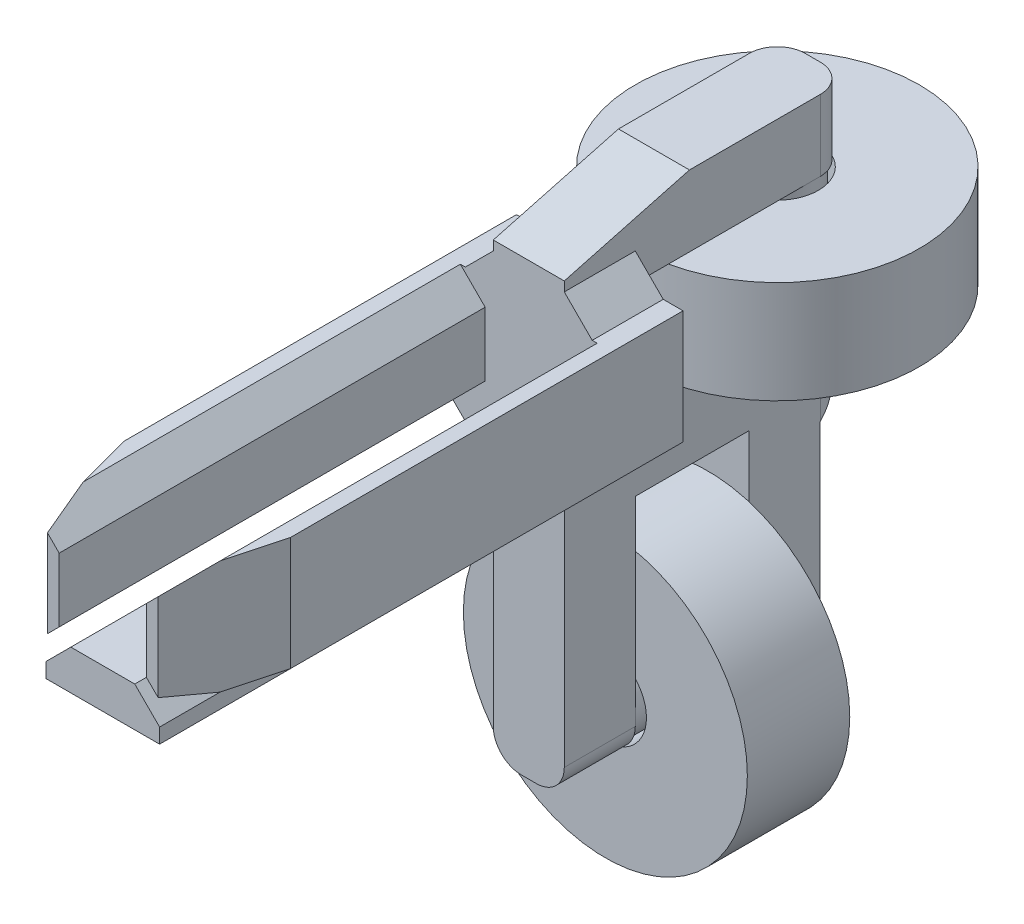
from build123d import *

# Parameters (mm, degrees)
BOSS_EXTRUDE1_DEPTH   = 38.1
BOSS_EXTRUDE1_2_DEPTH = 38.1
BOSS_EXTRUDE1_3_DEPTH = 38.1
CHAMFER1_SIZE         = 2.5
CHAMFER1_SIZE2        = 9.330127019
CHAMFER2_SIZE         = 2.5
CHAMFER2_SIZE2        = 9.330127019
BOSS_EXTRUDE2_DEPTH   = 6.35
BOSS_EXTRUDE3_START   = -6.35
SKETCH4_W             = 6.35
SKETCH4_H             = 6.35
BOSS_EXTRUDE3_DEPTH   = 25.4
BOSS_EXTRUDE4_REACH   = 44.186
SKETCH5_R             = 3.175
BOSS_EXTRUDE5_START   = 0.5
SKETCH6_R             = 12.7
SKETCH6_R_2           = 3.675
BOSS_EXTRUDE5_DEPTH   = 9.16
SKETCH7_W             = 6.35
SKETCH7_H             = 20.32
BOSS_EXTRUDE6_DEPTH   = 6.35
BOSS_EXTRUDE7_REACH   = 66.433
SKETCH8_R             = 3.175
BOSS_EXTRUDE8_START   = 0.5
SKETCH9_R             = 12.7
SKETCH9_R_2           = 3.675
BOSS_EXTRUDE8_DEPTH   = 9.16
CHAMFER3_SIZE         = 2.5
FILLET1_R             = 2.5
CHAMFER4_SIZE         = 3
CHAMFER4_SIZE2        = 11.196152423


with BuildPart() as part:
    # Sketch1 → Boss-Extrude1 (new body)
    with BuildSketch(Plane.XY):
        Polygon((6.12, -5.08), (3.9, -2.86), (3.9, 2.86), (6.12, 5.08), (7.45, 5.08), (7.45, -5.08), align=None)
    extrude(amount=BOSS_EXTRUDE1_DEPTH)

    # Chamfer1
    chamfer1_edges = [part.edges().sort_by_distance(p)[0] for p in [
        (7.45, 0, 38.1),
    ]]
    chamfer1_side = [part.faces().sort_by_distance(p)[0] for p in [
        (5.838807306, 0, 38.1),
    ]]
    chamfer(chamfer1_edges, length=CHAMFER1_SIZE, length2=CHAMFER1_SIZE2, reference=chamfer1_side[0])



with BuildPart() as body_2:
    # Sketch1 → Boss-Extrude1 2 (new body)
    with BuildSketch(Plane.XY):
        Polygon((-6.12, -5.08), (-3.9, -2.86), (-3.9, 2.86), (-6.12, 5.08), (-7.45, 5.08), (-7.45, -5.08), align=None)
    extrude(amount=BOSS_EXTRUDE1_2_DEPTH)

    # Chamfer2
    chamfer2_edges = [body_2.edges().sort_by_distance(p)[0] for p in [
        (-7.45, 0, 38.1),
    ]]
    chamfer2_side = [body_2.faces().sort_by_distance(p)[0] for p in [
        (-5.838807306, 0, 38.1),
    ]]
    chamfer(chamfer2_edges, length=CHAMFER2_SIZE, length2=CHAMFER2_SIZE2, reference=chamfer2_side[0])


with BuildPart() as body_3:
    # Sketch1 → Boss-Extrude1 3 (new body)
    with BuildSketch(Plane.XY):
        Polygon((5.08, -7.45), (-5.08, -7.45), (-5.08, -6.12), (-2.86, -3.9), (2.86, -3.9), (5.08, -6.12), align=None)
    extrude(amount=BOSS_EXTRUDE1_3_DEPTH)


with BuildPart() as part_1:
    add(part.part)

    add(body_2.part)  # Boss-Extrude2 merges body 2
    # Sketch3 → Boss-Extrude2 (add)
    with BuildSketch(Plane.XY):
        Polygon((7.45, 5.08), (-7.45, 5.08), (-7.45, -5.08), (-5.08, -7.45), (5.08, -7.45), (7.45, -5.08), align=None)
    extrude(amount=-BOSS_EXTRUDE2_DEPTH)

    # Sketch4 → Boss-Extrude3 (add)
    with BuildSketch(Plane(origin=(0, 0, -6.35), x_dir=(-1, 0, 0), z_dir=(0, 0, -1)).offset(BOSS_EXTRUDE3_START)):
        with Locations((0, 8.255)):
            Rectangle(SKETCH4_W, SKETCH4_H)
        with Locations((0, -8.255)):
            Rectangle(SKETCH4_W, SKETCH4_H)
    extrude(amount=BOSS_EXTRUDE3_DEPTH)

    # Sketch5 → Boss-Extrude4 (add, up to next)
    with BuildSketch(Plane(origin=(0, -5.08, 0), x_dir=(1, 0, 0), z_dir=(0, 1, 0)), mode=Mode.PRIVATE) as boss_extrude4_sk1:
        with Locations(Location((0, 22.225, 0), (0, 0, 90))):
            Circle(SKETCH5_R)
    boss_extrude4_tool1 = extrude(boss_extrude4_sk1.sketch, amount=BOSS_EXTRUDE4_REACH, mode=Mode.PRIVATE) - part_1.part
    add(boss_extrude4_tool1.solids().sort_by_distance((0, -5.08, -22.225))[0])

    # Sketch7 → Boss-Extrude6 (add)
    with BuildSketch(Plane(origin=(3.175, 0, 0), x_dir=(0, 0, -1), z_dir=(1, 0, 0))):
        with Locations((3.175, -21.59)):
            Rectangle(SKETCH7_W, SKETCH7_H)
        with Locations((19.685, -21.59)):
            Rectangle(SKETCH7_W, SKETCH7_H)
    extrude(amount=-BOSS_EXTRUDE6_DEPTH)

    # Sketch8 → Boss-Extrude7 (add, up to next)
    with BuildSketch(Plane.XY.offset(-16.51), mode=Mode.PRIVATE) as boss_extrude7_sk1:
        with Locations(Location((0, -28.575, 0), (0, 0, 180))):
            Circle(SKETCH8_R)
    boss_extrude7_tool1 = extrude(boss_extrude7_sk1.sketch, amount=BOSS_EXTRUDE7_REACH, mode=Mode.PRIVATE) - part_1.part
    add(boss_extrude7_tool1.solids().sort_by_distance((0, -28.575, -16.51))[0])

    # Chamfer3
    chamfer3_edges = [part_1.edges().sort_by_distance(p)[0] for p in [
        (0, -11.43, -22.86),
        (3.175, 5.08, -3.175),
        (-3.175, 5.08, -3.175),
    ]]
    chamfer(chamfer3_edges, length=CHAMFER3_SIZE)

    # Fillet1
    fillet1_edges = [part_1.edges().sort_by_distance(p)[0] for p in [
        (-3.175, -8.255, -25.4),
        (3.175, -8.255, -25.4),
        (-3.175, 8.255, -25.4),
        (3.175, 8.255, -25.4),
        (-3.175, -31.75, -3.175),
        (3.175, -31.75, -3.175),
        (-3.175, -31.75, -19.685),
        (3.175, -31.75, -19.685),
    ]]
    fillet(fillet1_edges, radius=FILLET1_R)

    # Chamfer4
    chamfer4_edges = [part_1.edges().sort_by_distance(p)[0] for p in [
        (0, 11.43, 0),
    ]]
    chamfer4_side = [part_1.faces().sort_by_distance(p)[0] for p in [
        (0, -8.69005842, 0),
    ]]
    chamfer(chamfer4_edges, length=CHAMFER4_SIZE, length2=CHAMFER4_SIZE2, reference=chamfer4_side[0])


with BuildPart() as body_3_2:
    # Sketch6 → Boss-Extrude5 (new body)
    with BuildSketch(Plane(origin=(0, -5.08, 0), x_dir=(1, 0, 0), z_dir=(0, 1, 0)).offset(BOSS_EXTRUDE5_START)):
        with Locations(Location((0, 22.225, 0), (0, 0, 270))):
            Circle(SKETCH6_R)
        with Locations(Location((0, 22.225, 0), (0, 0, 270))):
            Circle(SKETCH6_R_2, mode=Mode.SUBTRACT)
    extrude(amount=BOSS_EXTRUDE5_DEPTH)


with BuildPart() as body_4:
    # Sketch9 → Boss-Extrude8 (new body)
    with BuildSketch(Plane.XY.offset(-16.51).offset(BOSS_EXTRUDE8_START)):
        with Locations((0, -28.575)):
            Circle(SKETCH9_R)
        with Locations((0, -28.575)):
            Circle(SKETCH9_R_2, mode=Mode.SUBTRACT)
    extrude(amount=BOSS_EXTRUDE8_DEPTH)


solid = Compound([body_3.part, part_1.part, body_3_2.part, body_4.part])
